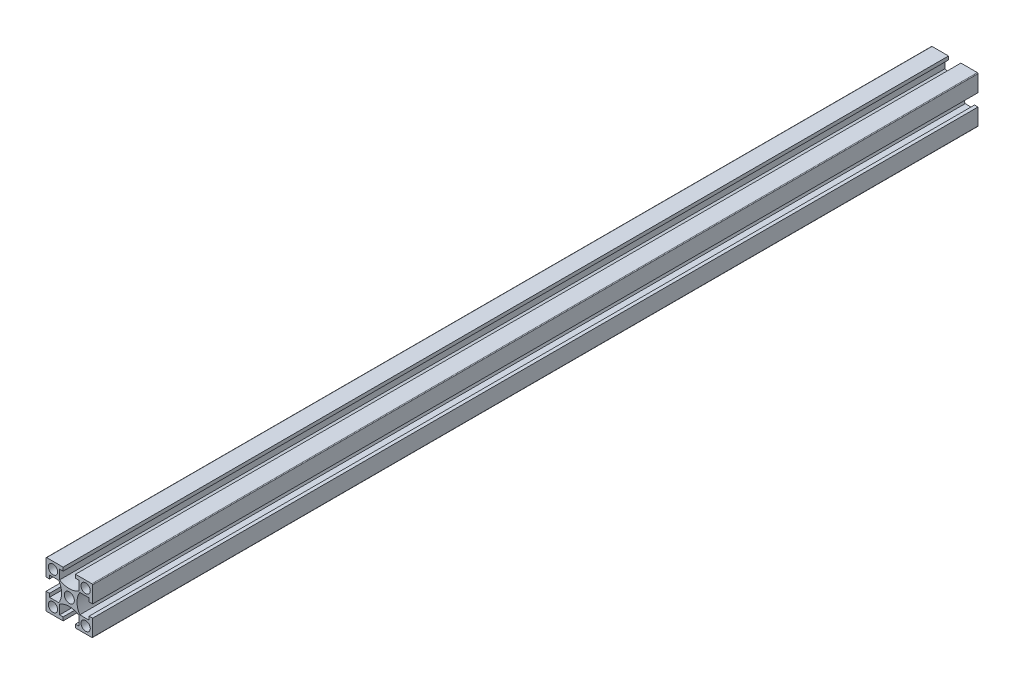
from build123d import *

# Parameters (mm, degrees)
SKETCH_1_W               = 20
SKETCH_1_H               = 20
SKETCH_1_R               = 2
SKETCH_1_R_2             = 2.15
EXTRUDE_1_DEPTH          = 380
CUT_EXTRUDE_1_REACH      = 382.263
PATTERN_CIRCULAR_1_COUNT = 4
FILLET_1_R               = 0.3


with BuildPart() as part:
    # 스케치1 → 보스-돌출1 (new body)
    with BuildSketch(Plane.XY):
        Rectangle(SKETCH_1_W, SKETCH_1_H)
        with Locations((-7, -7)):
            Circle(SKETCH_1_R, mode=Mode.SUBTRACT)
        with Locations((7, -7)):
            Circle(SKETCH_1_R, mode=Mode.SUBTRACT)
        with Locations((-7, 7)):
            Circle(SKETCH_1_R, mode=Mode.SUBTRACT)
        Circle(SKETCH_1_R_2, mode=Mode.SUBTRACT)
        with Locations((7, 7)):
            Circle(SKETCH_1_R, mode=Mode.SUBTRACT)
    extrude(amount=EXTRUDE_1_DEPTH)

    # 스케치1<3> → 컷-돌출1 (cut, up to next)
    with BuildSketch(Plane.XY, mode=Mode.PRIVATE) as cut_extrude_1_sk1:
        with BuildLine():
            Line((-8.5, 2.65), (-10, 2.65))
            Line((-10, 2.65), (-10, -2.65))
            Line((-10, -2.65), (-8.5, -2.65))
            Line((-8.5, -2.65), (-8.5, -4.15))
            Line((-8.5, -4.15), (-4.503166667, -4.15))
            ThreePointArc((-4.503166667, -4.15), (-3.3, 0), (-4.503166667, 4.15))
            Line((-4.503166667, 4.15), (-8.5, 4.15))
            Line((-8.5, 4.15), (-8.5, 2.65))
        make_face()
    cut_extrude_1_tool1 = extrude(cut_extrude_1_sk1.sketch, amount=CUT_EXTRUDE_1_REACH, mode=Mode.PRIVATE) & part.part
    cut_extrude_1 = cut_extrude_1_tool1.solids().sort_by_distance((-6.606913, 0, 0))[0]
    add(cut_extrude_1, mode=Mode.SUBTRACT)

    # 원형 패턴1: 컷-돌출1 ×4 about axis
    pattern_circular_1_axis = Axis((0, 0, 380), (0, 0, -1))
    for i in range(1, PATTERN_CIRCULAR_1_COUNT):
        add(cut_extrude_1.rotate(pattern_circular_1_axis, i * 360 / PATTERN_CIRCULAR_1_COUNT), mode=Mode.SUBTRACT)

    # 필렛1
    fillet_1_edges = [part.edges().sort_by_distance(p)[0] for p in [
        (10, -10, 190),
        (-10, -10, 190),
        (-10, 10, 190),
        (10, 10, 190),
    ]]
    fillet(fillet_1_edges, radius=FILLET_1_R)


solid = part.part
